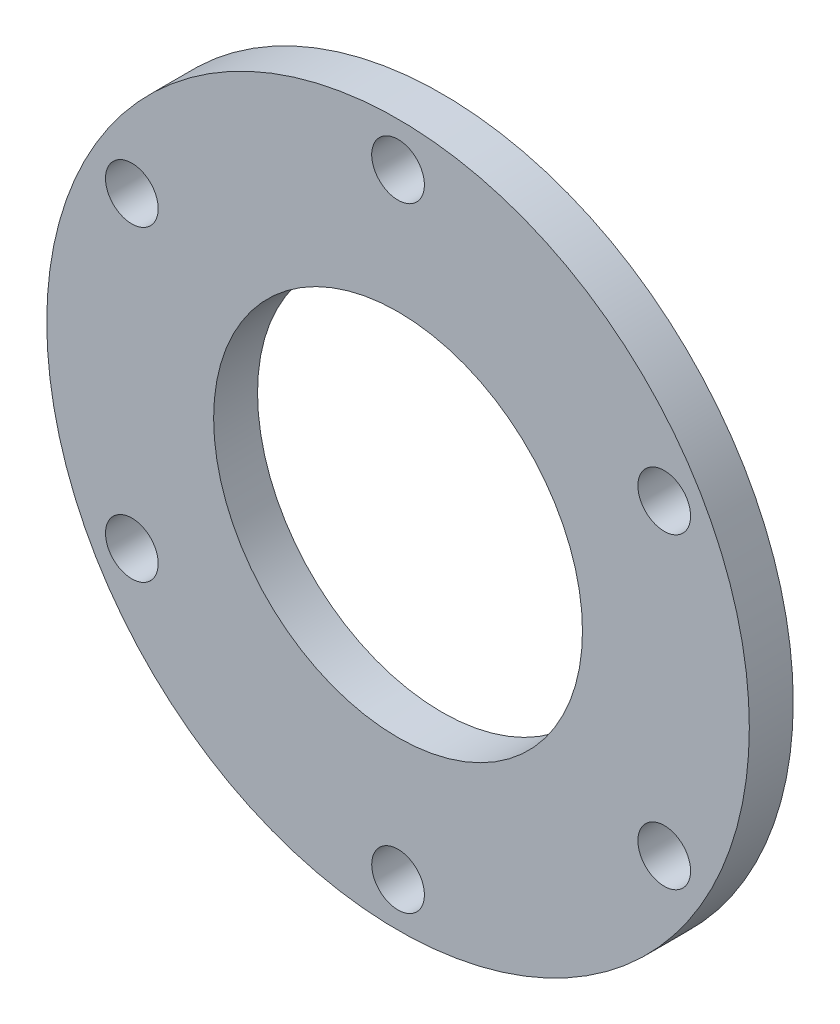
from build123d import *

# Parameters (mm, degrees)
SKETCH1_R           = 25.4
SKETCH1_R_2         = 13.335
BOSS_EXTRUDE1_DEPTH = 3.175
SKETCH2_R           = 1.905
CUT_EXTRUDE1_DEPTH  = 37.061067996
CIRPATTERN1_COUNT   = 6


with BuildPart() as part:
    # Sketch1 → Boss-Extrude1 (new body)
    with BuildSketch(Plane.XY):
        Circle(SKETCH1_R)
        Circle(SKETCH1_R_2, mode=Mode.SUBTRACT)
    extrude(amount=BOSS_EXTRUDE1_DEPTH)

    # Sketch2 → Cut-Extrude1 (cut, through all)
    with BuildSketch(Plane.XY.offset(3.175)):
        with Locations((0, 22.225)):
            Circle(SKETCH2_R)
    cut_extrude1 = extrude(amount=-CUT_EXTRUDE1_DEPTH, mode=Mode.SUBTRACT)

    # CirPattern1: Cut-Extrude1 ×6 about axis
    cirpattern1_axis = Axis((0, 0, 0), (0, 0, 1))
    for i in range(1, CIRPATTERN1_COUNT):
        add(cut_extrude1.rotate(cirpattern1_axis, i * 360 / CIRPATTERN1_COUNT), mode=Mode.SUBTRACT)


solid = part.part
